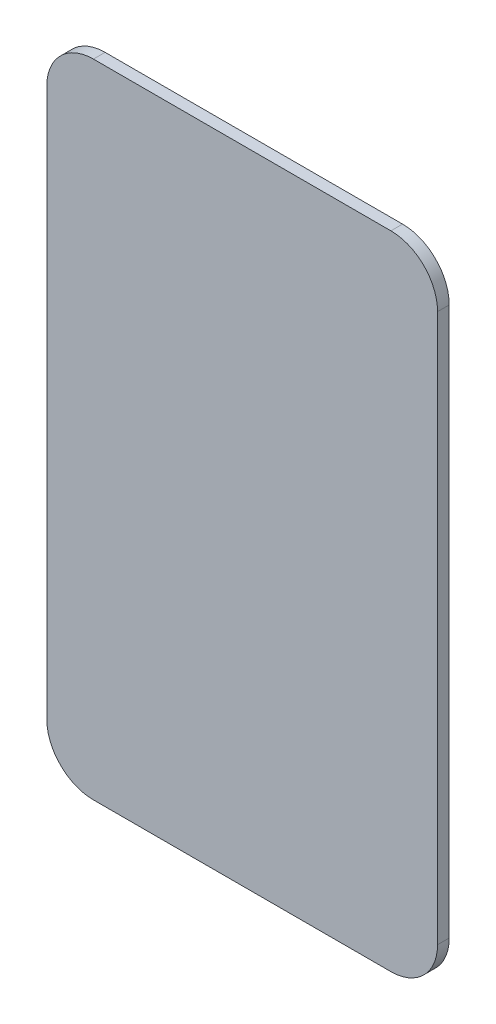
from build123d import *

# Parameters (mm, degrees)
BOSS_EXTRUDE1_DEPTH = 25.4


with BuildPart() as part:
    # Sketch2 → Boss-Extrude1 (new body)
    with BuildSketch(Plane.XY):
        with BuildLine():
            Line((63.5, 165.1), (63.5, 1358.9))
            ThreePointArc((63.5, 1358.9), (93.257951031, 1430.742048969), (165.1, 1460.5))
            Line((165.1, 1460.5), (812.8, 1460.5))
            ThreePointArc((812.8, 1460.5), (884.642048969, 1430.742048969), (914.4, 1358.9))
            Line((914.4, 1358.9), (914.4, 165.1))
            ThreePointArc((914.4, 165.1), (884.642048969, 93.257951031), (812.8, 63.5))
            Line((812.8, 63.5), (165.1, 63.5))
            ThreePointArc((165.1, 63.5), (93.257951031, 93.257951031), (63.5, 165.1))
        make_face()
    extrude(amount=BOSS_EXTRUDE1_DEPTH)


solid = part.part
